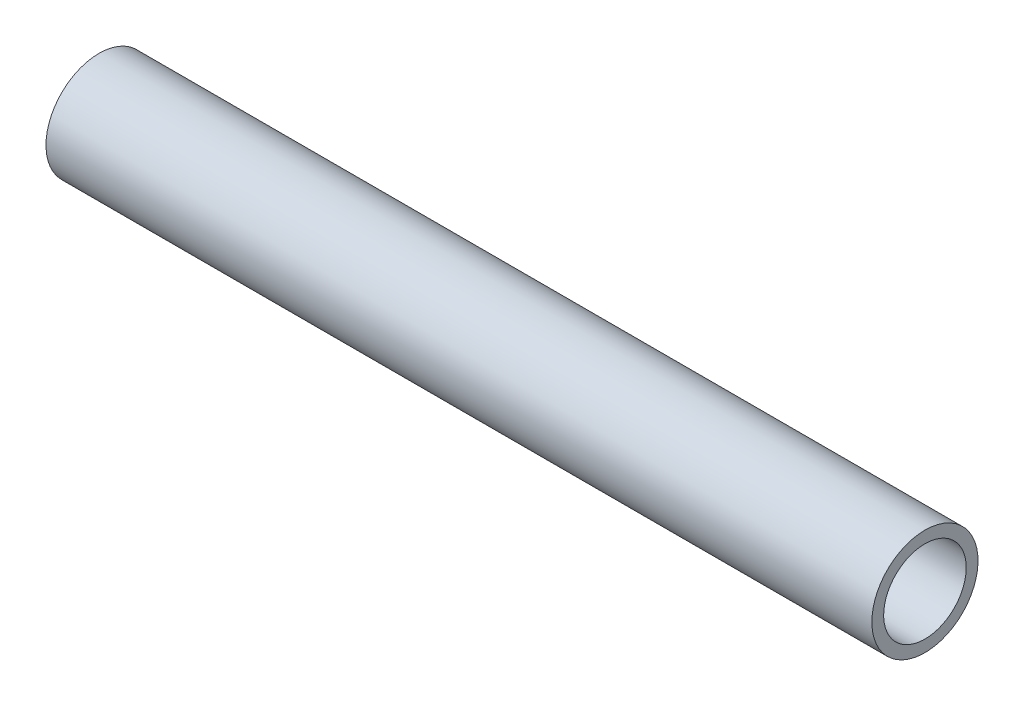
from build123d import *

# Parameters (mm, degrees)
SKETCH1_W      = 2800
SKETCH1_H      = 40
REVOLVE1_ANGLE = 359.999999589


with BuildPart() as part:
    # Sketch1 → Revolve1 (revolve)
    with BuildSketch(Plane.XY):
        with Locations((3300, 160)):
            Rectangle(SKETCH1_W, SKETCH1_H)
    revolve(axis=Axis((0, 0, 0), (1, 0, 0)), revolution_arc=REVOLVE1_ANGLE)


solid = part.part
